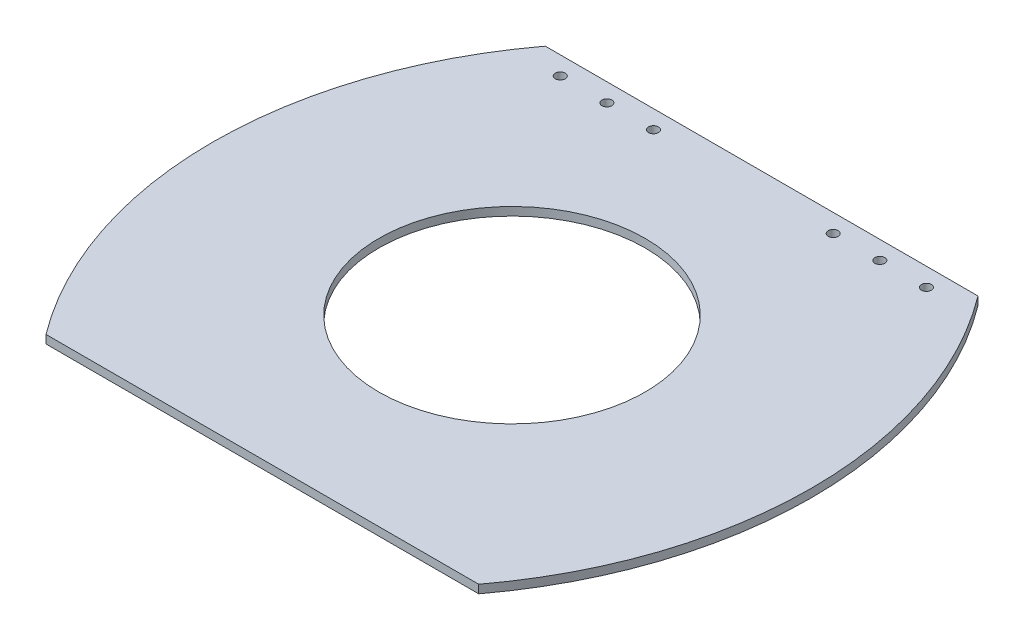
from build123d import *

# Parameters (mm, degrees)
BOSS_EXTRUDE1_DEPTH = 5
SKETCH2_R           = 80
CUT_EXTRUDE5_DEPTH  = 10
SKETCH3_R           = 3
CUT_EXTRUDE6_DEPTH  = 235.360832905


with BuildPart() as part:
    # Lid case → Boss-Extrude1 (new body)
    with BuildSketch(Plane(origin=(0, 0, 0), x_dir=(1, 0, 0), z_dir=(0, 1, 0))):
        with BuildLine():
            Line((-130, 150), (130, 150))
            ThreePointArc((130, 150), (180, 0), (130, -150))
            Line((130, -150), (-130, -150))
            ThreePointArc((-130, -150), (-180, 0), (-130, 150))
        make_face()
    extrude(amount=BOSS_EXTRUDE1_DEPTH)

    # Sketch2 → Cut-Extrude5 (cut)
    with BuildSketch(Plane.XZ):
        Circle(SKETCH2_R)
    extrude(amount=-CUT_EXTRUDE5_DEPTH, mode=Mode.SUBTRACT)

    # Sketch3 → Cut-Extrude6 (cut, through all)
    with BuildSketch(Plane(origin=(0, 5, 0), x_dir=(1, 0, 0), z_dir=(0, 1, 0))):
        with Locations((-110, 139)):
            Circle(SKETCH3_R)
        with Locations((-82, 139)):
            Circle(SKETCH3_R)
        with Locations((-54, 139)):
            Circle(SKETCH3_R)
        with Locations((54, 139)):
            Circle(SKETCH3_R)
        with Locations((82, 139)):
            Circle(SKETCH3_R)
        with Locations((110, 139)):
            Circle(SKETCH3_R)
    extrude(amount=-CUT_EXTRUDE6_DEPTH, mode=Mode.SUBTRACT)


solid = part.part
